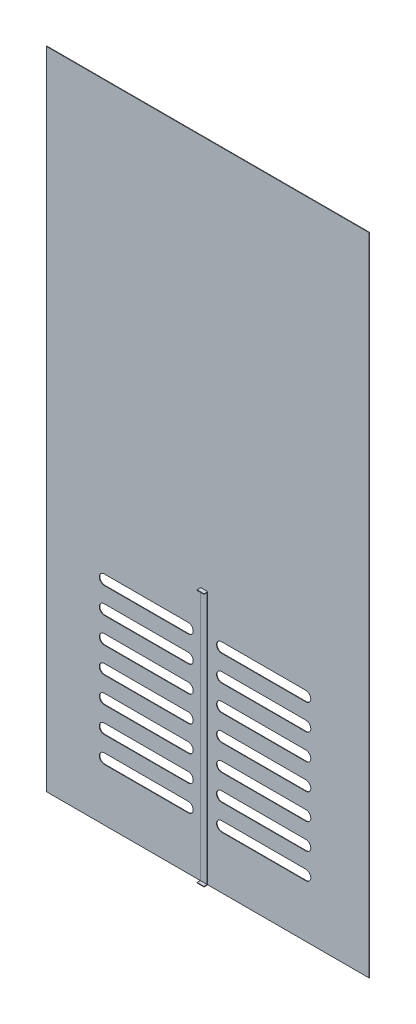
from build123d import *

# Parameters (mm, degrees)
SKETCH1_W           = 500
SKETCH1_H           = 1000
BOSS_EXTRUDE1_DEPTH = 0.8
SKETCH4_W           = 10.782807929
SKETCH4_H           = 393.4
BOSS_EXTRUDE3_DEPTH = 0.8
SKETCH6_W           = 10.782807929
SKETCH6_H           = 5
BOSS_EXTRUDE4_DEPTH = 0.8
SKETCH7_W           = 10.782807929
SKETCH7_H           = 5
BOSS_EXTRUDE5_DEPTH = 0.8


with BuildPart() as part:
    # Sketch1 → Boss-Extrude1 (new body)
    with BuildSketch(Plane.XY):
        with Locations((250, 500)):
            Rectangle(SKETCH1_W, SKETCH1_H)
        with BuildLine():
            Line((89.759227751, 336.925516305), (219.774729178, 336.925516305))
            ThreePointArc((219.774729178, 336.925516305), (227.515924038, 329.184321446), (219.774729178, 321.443126586))
            Line((219.774729178, 321.443126586), (89.759227751, 321.443126586))
            ThreePointArc((89.759227751, 321.443126586), (82.018032891, 329.184321446), (89.759227751, 336.925516305))
        make_face(mode=Mode.SUBTRACT)
        with BuildLine():
            Line((271.405433716, 336.925516305), (401.890305185, 336.925516305))
            ThreePointArc((401.890305185, 336.925516305), (409.631500044, 329.184321446), (401.890305185, 321.443126586))
            Line((401.890305185, 321.443126586), (271.405433716, 321.443126586))
            ThreePointArc((271.405433716, 321.443126586), (263.664238856, 329.184321446), (271.405433716, 336.925516305))
        make_face(mode=Mode.SUBTRACT)
        with BuildLine():
            Line((271.405433716, 281.443126586), (401.890305185, 281.443126586))
            ThreePointArc((401.890305185, 281.443126586), (409.631500044, 289.184321446), (401.890305185, 296.925516305))
            Line((401.890305185, 296.925516305), (271.405433716, 296.925516305))
            ThreePointArc((271.405433716, 296.925516305), (263.664238856, 289.184321446), (271.405433716, 281.443126586))
        make_face(mode=Mode.SUBTRACT)
        with BuildLine():
            Line((89.759227751, 281.443126586), (219.774729178, 281.443126586))
            ThreePointArc((219.774729178, 281.443126586), (227.515924038, 289.184321446), (219.774729178, 296.925516305))
            Line((219.774729178, 296.925516305), (89.759227751, 296.925516305))
            ThreePointArc((89.759227751, 296.925516305), (82.018032891, 289.184321446), (89.759227751, 281.443126586))
        make_face(mode=Mode.SUBTRACT)
        with BuildLine():
            Line((271.405433716, 256.925516305), (401.890305185, 256.925516305))
            ThreePointArc((401.890305185, 256.925516305), (409.631500044, 249.184321446), (401.890305185, 241.443126586))
            Line((401.890305185, 241.443126586), (271.405433716, 241.443126586))
            ThreePointArc((271.405433716, 241.443126586), (263.664238856, 249.184321446), (271.405433716, 256.925516305))
        make_face(mode=Mode.SUBTRACT)
        with BuildLine():
            Line((271.405433716, 201.443126586), (401.890305185, 201.443126586))
            ThreePointArc((401.890305185, 201.443126586), (409.631500044, 209.184321446), (401.890305185, 216.925516305))
            Line((401.890305185, 216.925516305), (271.405433716, 216.925516305))
            ThreePointArc((271.405433716, 216.925516305), (263.664238856, 209.184321446), (271.405433716, 201.443126586))
        make_face(mode=Mode.SUBTRACT)
        with BuildLine():
            Line((89.759227751, 256.925516305), (219.774729178, 256.925516305))
            ThreePointArc((219.774729178, 256.925516305), (227.515924038, 249.184321446), (219.774729178, 241.443126586))
            Line((219.774729178, 241.443126586), (89.759227751, 241.443126586))
            ThreePointArc((89.759227751, 241.443126586), (82.018032891, 249.184321446), (89.759227751, 256.925516305))
        make_face(mode=Mode.SUBTRACT)
        with BuildLine():
            Line((89.759227751, 201.443126586), (219.774729178, 201.443126586))
            ThreePointArc((219.774729178, 201.443126586), (227.515924038, 209.184321446), (219.774729178, 216.925516305))
            Line((219.774729178, 216.925516305), (89.759227751, 216.925516305))
            ThreePointArc((89.759227751, 216.925516305), (82.018032891, 209.184321446), (89.759227751, 201.443126586))
        make_face(mode=Mode.SUBTRACT)
        with BuildLine():
            Line((271.405433716, 176.925516305), (401.890305185, 176.925516305))
            ThreePointArc((401.890305185, 176.925516305), (409.631500044, 169.184321446), (401.890305185, 161.443126586))
            Line((401.890305185, 161.443126586), (271.405433716, 161.443126586))
            ThreePointArc((271.405433716, 161.443126586), (263.664238856, 169.184321446), (271.405433716, 176.925516305))
        make_face(mode=Mode.SUBTRACT)
        with BuildLine():
            Line((89.759227751, 176.925516305), (219.774729178, 176.925516305))
            ThreePointArc((219.774729178, 176.925516305), (227.515924038, 169.184321446), (219.774729178, 161.443126586))
            Line((219.774729178, 161.443126586), (89.759227751, 161.443126586))
            ThreePointArc((89.759227751, 161.443126586), (82.018032891, 169.184321446), (89.759227751, 176.925516305))
        make_face(mode=Mode.SUBTRACT)
        with BuildLine():
            Line((89.759227751, 121.443126586), (219.774729178, 121.443126586))
            ThreePointArc((219.774729178, 121.443126586), (227.515924038, 129.184321446), (219.774729178, 136.925516305))
            Line((219.774729178, 136.925516305), (89.759227751, 136.925516305))
            ThreePointArc((89.759227751, 136.925516305), (82.018032891, 129.184321446), (89.759227751, 121.443126586))
        make_face(mode=Mode.SUBTRACT)
        with BuildLine():
            Line((271.405433716, 121.443126586), (401.890305185, 121.443126586))
            ThreePointArc((401.890305185, 121.443126586), (409.631500044, 129.184321446), (401.890305185, 136.925516305))
            Line((401.890305185, 136.925516305), (271.405433716, 136.925516305))
            ThreePointArc((271.405433716, 136.925516305), (263.664238856, 129.184321446), (271.405433716, 121.443126586))
        make_face(mode=Mode.SUBTRACT)
        with BuildLine():
            Line((271.405433716, 96.925516305), (401.890305185, 96.925516305))
            ThreePointArc((401.890305185, 96.925516305), (409.631500044, 89.184321446), (401.890305185, 81.443126586))
            Line((401.890305185, 81.443126586), (271.405433716, 81.443126586))
            ThreePointArc((271.405433716, 81.443126586), (263.664238856, 89.184321446), (271.405433716, 96.925516305))
        make_face(mode=Mode.SUBTRACT)
        with BuildLine():
            Line((89.759227751, 96.925516305), (219.774729178, 96.925516305))
            ThreePointArc((219.774729178, 96.925516305), (227.515924038, 89.184321446), (219.774729178, 81.443126586))
            Line((219.774729178, 81.443126586), (89.759227751, 81.443126586))
            ThreePointArc((89.759227751, 81.443126586), (82.018032891, 89.184321446), (89.759227751, 96.925516305))
        make_face(mode=Mode.SUBTRACT)
    extrude(amount=BOSS_EXTRUDE1_DEPTH)

    # Sketch4 → Boss-Extrude3 (add)
    with BuildSketch(Plane.XY.offset(0.8)):
        with Locations((244.608596036, 196.7)):
            Rectangle(SKETCH4_W, SKETCH4_H)
    extrude(amount=BOSS_EXTRUDE3_DEPTH)

    # Sketch6 → Boss-Extrude4 (add)
    with BuildSketch(Plane(origin=(0, 393.4, 0), x_dir=(1, 0, 0), z_dir=(0, 1, 0))):
        with Locations((244.608596036, -4.1)):
            Rectangle(SKETCH6_W, SKETCH6_H)
    extrude(amount=-BOSS_EXTRUDE4_DEPTH)

    # Sketch7 → Boss-Extrude5 (add)
    with BuildSketch(Plane(origin=(0, 0, 0), x_dir=(-1, 0, 0), z_dir=(0, -1, 0))):
        with Locations((-244.608596036, -4.1)):
            Rectangle(SKETCH7_W, SKETCH7_H)
    extrude(amount=-BOSS_EXTRUDE5_DEPTH)


solid = part.part
